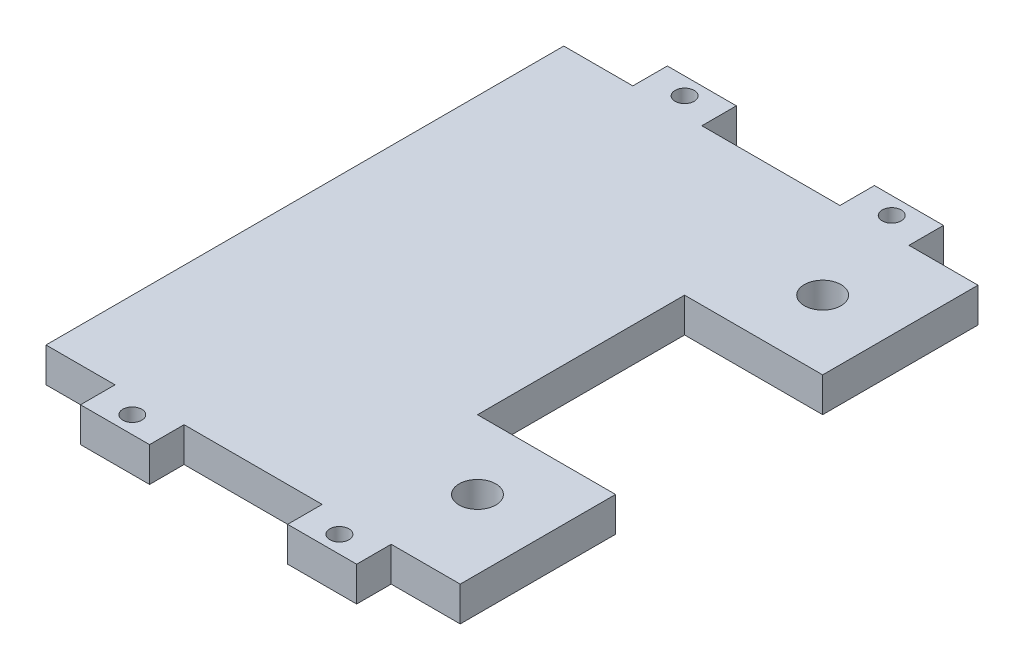
from build123d import *

# Parameters (mm, degrees)
SKETCH1_W                 = 76.2
SKETCH1_H                 = 107.95
BOSS_EXTRUDE1_DEPTH       = 6.35
SKETCH2_R                 = 1.7526
SKETCH2_W                 = 12.7
SKETCH2_H                 = 6.35
SKETCH2_W_2               = 25.4
CUT_EXTRUDE1_DEPTH        = 6.35
CUT_EXTRUDE2_REACH        = 68.372
SKETCH3_W                 = 25.4
SKETCH3_H                 = 38.1
F_6_CLEARANCE_HOLE1_D     = 3.5052
F_6_CLEARANCE_HOLE1_DEPTH = 6.35
F_6_CLEARANCE_HOLE1_TIP   = 1.053068321
F_1_4_CLEARANCE_HOLE1_D   = 6.7564


with BuildPart() as part:
    # Sketch1 → Boss-Extrude1 (new body)
    with BuildSketch(Plane(origin=(0, 0, 0), x_dir=(1, 0, 0), z_dir=(0, 1, 0))):
        Rectangle(SKETCH1_W, SKETCH1_H)
    extrude(amount=BOSS_EXTRUDE1_DEPTH)

    # Sketch2 → Cut-Extrude1 (cut)
    with BuildSketch(Plane(origin=(0, 6.35, 0), x_dir=(1, 0, 0), z_dir=(0, 1, 0))):
        with Locations(Location((-19.05, 50.8, 0), (0, 0, 270))):
            Circle(SKETCH2_R)
        with Locations(Location((19.05, 50.8, 0), (0, 0, 270))):
            Circle(SKETCH2_R)
        with Locations(Location((19.05, -50.8, 0), (0, 0, 90))):
            Circle(SKETCH2_R)
        with Locations(Location((-19.05, -50.8, 0), (0, 0, 90))):
            Circle(SKETCH2_R)
        with Locations((-31.75, 50.8)):
            Rectangle(SKETCH2_W, SKETCH2_H)
        with Locations((0, 50.8)):
            Rectangle(SKETCH2_W_2, SKETCH2_H)
        with Locations((31.75, 50.8)):
            Rectangle(SKETCH2_W, SKETCH2_H)
        with Locations((31.75, -50.8)):
            Rectangle(SKETCH2_W, SKETCH2_H)
        with Locations((0, -50.8)):
            Rectangle(SKETCH2_W_2, SKETCH2_H)
        with Locations((-31.75, -50.8)):
            Rectangle(SKETCH2_W, SKETCH2_H)
    extrude(amount=-CUT_EXTRUDE1_DEPTH, mode=Mode.SUBTRACT)

    # Sketch3 → Cut-Extrude2 (cut, up to next)
    with BuildSketch(Plane(origin=(0, 6.35, 0), x_dir=(1, 0, 0), z_dir=(0, 1, 0)), mode=Mode.PRIVATE) as cut_extrude2_sk1:
        with Locations((25.4, 0)):
            Rectangle(SKETCH3_W, SKETCH3_H)
    cut_extrude2_tool1 = extrude(cut_extrude2_sk1.sketch, amount=-CUT_EXTRUDE2_REACH, mode=Mode.PRIVATE) & part.part
    add(cut_extrude2_tool1.solids().sort_by_distance((25.4, 6.35, 0))[0], mode=Mode.SUBTRACT)

    # #6 Clearance Hole1
    with Locations(Plane(origin=(0, 6.35, 0), x_dir=(1, 0, 0), z_dir=(0, 1, 0))):
        with Locations((-19.05, 50.8), (19.05, 50.8), (-19.05, -50.8), (19.05, -50.8)):
            Hole(F_6_CLEARANCE_HOLE1_D / 2, depth=F_6_CLEARANCE_HOLE1_DEPTH)
            with Locations((0, 0, -(F_6_CLEARANCE_HOLE1_DEPTH + F_6_CLEARANCE_HOLE1_TIP / 2))):  # 118° drill point
                Cone(0, F_6_CLEARANCE_HOLE1_D / 2, F_6_CLEARANCE_HOLE1_TIP, mode=Mode.SUBTRACT)

    # 1/4 Clearance Hole1 (through all)
    with Locations(Plane(origin=(0, 0, 0), x_dir=(-1, 0, 0), z_dir=(0, -1, 0))):
        with Locations((-25.4, 31.75), (-25.4, -31.75)):
            Hole(F_1_4_CLEARANCE_HOLE1_D / 2)


solid = part.part
